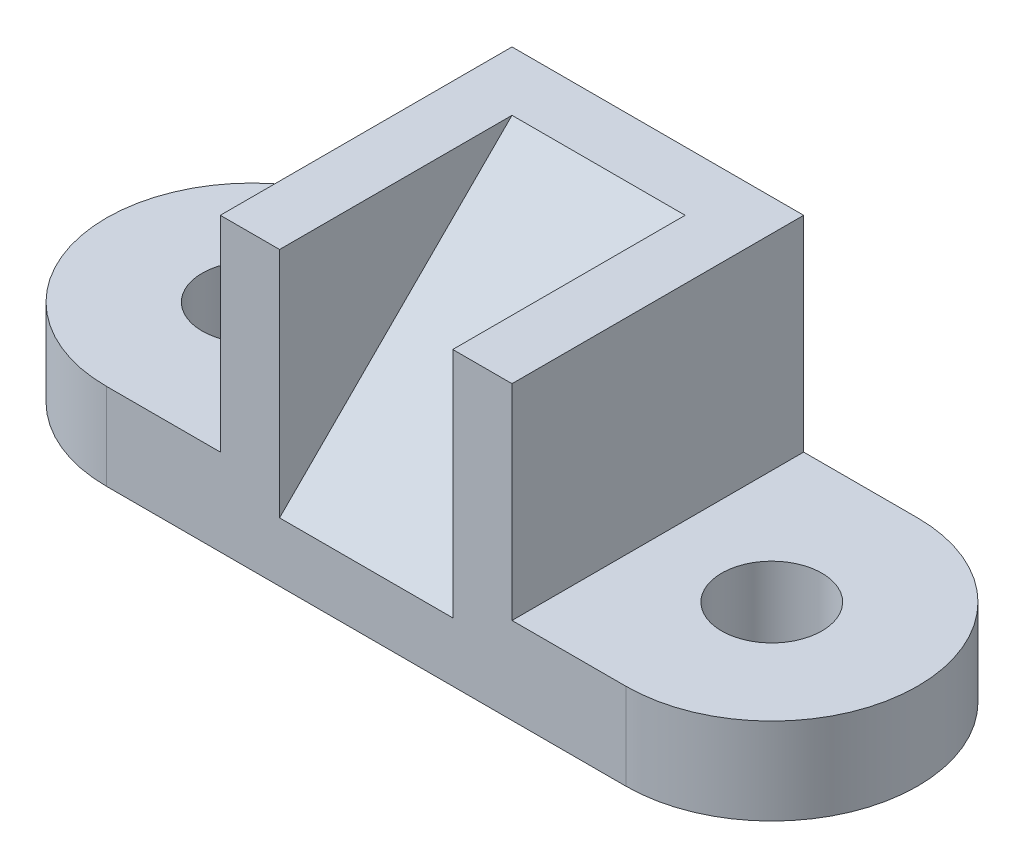
from build123d import *

# Parameters (mm, degrees)
SKETCH2_R           = 11
BOSS_EXTRUDE1_DEPTH = 19
SKETCH3_W           = 64
SKETCH3_H           = 64
BOSS_EXTRUDE2_DEPTH = 45
CUT_EXTRUDE1_DEPTH  = 19


with BuildPart() as part:
    # Sketch2 → Boss-Extrude1 (new body)
    with BuildSketch(Plane(origin=(0, 0, 0), x_dir=(1, 0, 0), z_dir=(0, 1, 0))):
        with BuildLine():
            Line((0, 32), (114, 32))
            ThreePointArc((114, 32), (146, 0), (114, -32))
            Line((114, -32), (0, -32))
            ThreePointArc((0, -32), (-32, 0), (0, 32))
        make_face()
        with Locations(Location((0, 0, 0), (0, 0, 270))):
            Circle(SKETCH2_R, mode=Mode.SUBTRACT)
        with Locations(Location((114, 0, 0), (0, 0, 270))):
            Circle(SKETCH2_R, mode=Mode.SUBTRACT)
    extrude(amount=BOSS_EXTRUDE1_DEPTH)

    # Sketch3 → Boss-Extrude2 (add)
    with BuildSketch(Plane(origin=(0, 19, 0), x_dir=(1, 0, 0), z_dir=(0, 1, 0))):
        with Locations((57, 0)):
            Rectangle(SKETCH3_W, SKETCH3_H)
    extrude(amount=BOSS_EXTRUDE2_DEPTH)

    # Sketch4 → Cut-Extrude1 (cut, symmetric)
    with BuildSketch(Plane.ZY.offset(-57)):
        Polygon((-19, 64), (32, 13), (32, 64), align=None)
    extrude(amount=CUT_EXTRUDE1_DEPTH, both=True, mode=Mode.SUBTRACT)


solid = part.part
